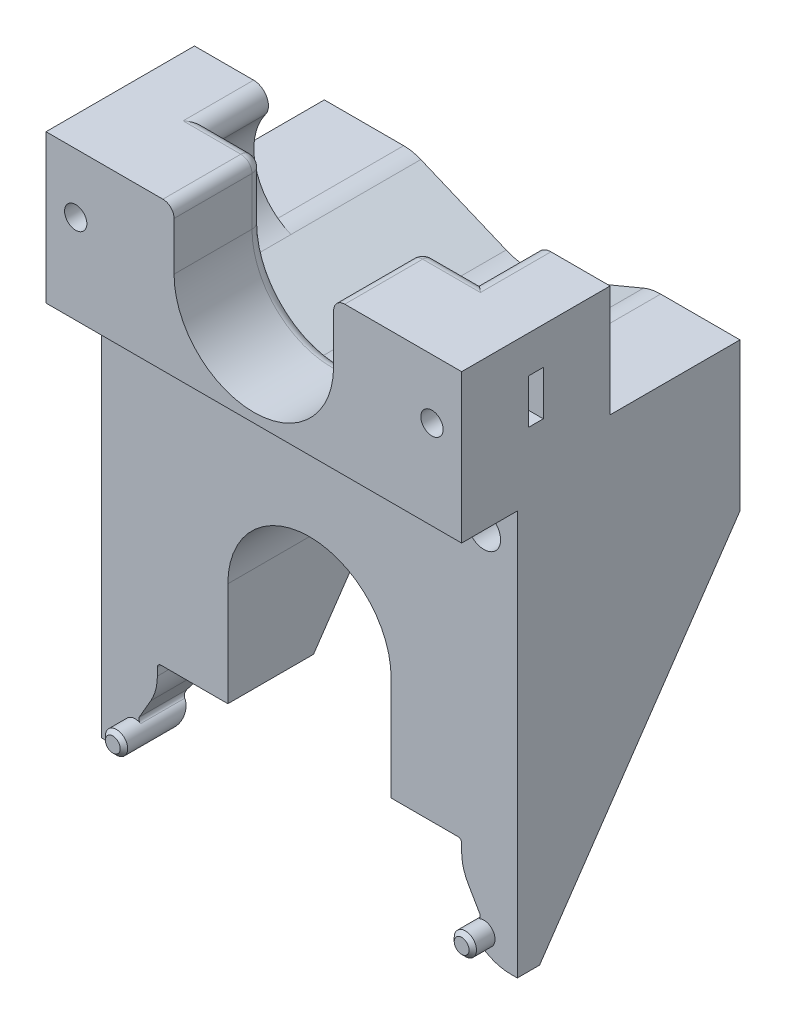
from build123d import *

# Parameters (mm, degrees)
BOSS_EXTRUDE1_DEPTH      = 28
BOSS_EXTRUDE1_DEPTH_BACK = 28
CUT_EXTRUDE1_REACH       = 65.151
BOSS_EXTRUDE2_START      = 3
SKETCH5_R                = 1.5000000000000009
BOSS_EXTRUDE2_DEPTH      = 3
CHAMFER1_SIZE            = 0.5
CUT_EXTRUDE2_REACH       = 65.151
SKETCH6_R                = 2.2499999999999987
SKETCH7_R                = 3.7499999999999996
CUT_EXTRUDE3_DEPTH       = 3
CUT_EXTRUDE4_REACH       = 69.039
CUT_EXTRUDE5_DEPTH       = 25.5
FILLET1_R                = 1.5
CUT_EXTRUDE6_DEPTH       = 17.5
CUT_EXTRUDE7_REACH       = 61.059
SKETCH11_R               = 1.5000000000000009
SKETCH11_R_2             = 1.4999999999999987
SKETCH12_W               = 6.9999999999999964
SKETCH12_H               = 5.999999999999993
CUT_EXTRUDE8_DEPTH       = 1


with BuildPart() as part:
    # Sketch3 → Boss-Extrude1 (new, two sides: drawn at the far end of the back side and taken through both)
    with BuildSketch(Plane(origin=(0, 0, 0), x_dir=(0, 0, -1), z_dir=(1, 0, 0)).offset(-BOSS_EXTRUDE1_DEPTH_BACK)):
        Polygon((0, -26.500000000000004), (0, 0), (0, 28.000000000000007), (-7.499999999999999, 28.000000000000007), (-7.5, 48), (29.999999999999996, 48.000000000000014), (30.000000000000004, 13.000000000000009), (3, -26.500000000000004), align=None)
    extrude(amount=BOSS_EXTRUDE1_DEPTH + BOSS_EXTRUDE1_DEPTH_BACK)

    # Cut-Extrude1: up to this plane
    cut_extrude1_end = Plane(origin=(27.999999999999993, 13.000000000000009, -30.000000000000004), z_dir=(0, 0.5643092286475101, 0.8255635011695056))
    # Sketch4 → Cut-Extrude1 (cut, up to the surface)
    with BuildSketch(Plane.XY, mode=Mode.PRIVATE) as cut_extrude1_sk1:
        with BuildLine():
            Line((-22.93301270189222, -21.517949192431118), (-21.387088719442275, -18.84033031018861))
            ThreePointArc((-21.387088719442275, -18.84033031018861), (-20.725616019582173, -17.24339394704681), (-20.5, -15.529670138408827))
            Line((-20.5, -15.529670138408827), (-20.5, -14.499999999999995))
            ThreePointArc((-20.5, -14.499999999999995), (-20.353553390593273, -14.146446609406722), (-20, -13.999999999999995))
            Line((-20, -13.999999999999995), (-10.999999999999998, -13.999999999999995))
            Line((-10.999999999999998, -13.999999999999995), (-11, -1.35e-15))
            ThreePointArc((-11, -1.35e-15), (-1.179e-14, 11), (10.999999999999993, 1.253e-14))
            Line((10.999999999999993, 1.253e-14), (10.999999999999991, -13.999999999999968))
            Line((10.999999999999991, -13.999999999999968), (20.000000000000007, -13.99999999999999))
            ThreePointArc((20.000000000000007, -13.99999999999999), (20.353553390593284, -14.146446609406715), (20.500000000000014, -14.499999999999991))
            Line((20.500000000000014, -14.499999999999991), (20.500000000000014, -15.529670138408822))
            ThreePointArc((20.500000000000014, -15.529670138408822), (20.725616019582187, -17.2433939470468), (21.38708871944229, -18.8403303101886))
            Line((21.38708871944229, -18.8403303101886), (22.933012701892235, -21.51794919243111))
            ThreePointArc((22.933012701892235, -21.51794919243111), (22.98296291314455, -21.897358714982374), (22.750000000000018, -22.200961894323335))
            ThreePointArc((22.750000000000018, -22.200961894323335), (22.012832707939275, -23.304210711669903), (22.43933982822019, -24.560660171779812))
            ThreePointArc((22.43933982822019, -24.560660171779812), (24.587450747697442, -25.99598200005571), (27.12132034355963, -26.499999999999993))
            Line((27.12132034355963, -26.499999999999993), (-27.12132034355962, -26.5))
            ThreePointArc((-27.12132034355962, -26.5), (-24.58745074769743, -25.99598200005572), (-22.43933982822018, -24.56066017177982))
            ThreePointArc((-22.43933982822018, -24.56066017177982), (-22.01283270793929, -23.30421071166992), (-22.750000000000004, -22.200961894323342))
            ThreePointArc((-22.750000000000004, -22.200961894323342), (-22.982962913144537, -21.89735871498238), (-22.93301270189222, -21.517949192431118))
        make_face()
    cut_extrude1_tool1 = split(extrude(cut_extrude1_sk1.sketch, amount=-CUT_EXTRUDE1_REACH, mode=Mode.PRIVATE), bisect_by=cut_extrude1_end, keep=Keep.BOTH, mode=Mode.PRIVATE)
    add(cut_extrude1_tool1.solids().sort_by_distance((0, -11.913251, 0))[0], mode=Mode.SUBTRACT)

    # Sketch5 → Boss-Extrude2 (add)
    with BuildSketch(Plane.XY.offset(BOSS_EXTRUDE2_START)):
        with Locations((23.499999999999996, -23.5)):
            Circle(SKETCH5_R)
        with Locations((-23.500000000000004, -23.5)):
            Circle(SKETCH5_R)
    extrude(amount=-BOSS_EXTRUDE2_DEPTH)

    # Chamfer1
    chamfer1_edges = [part.edges().sort_by_distance(p)[0] for p in [
        (21.999999999999996, -23.5, 3),
        (-25.000000000000004, -23.5, 3),
    ]]
    chamfer(chamfer1_edges, length=CHAMFER1_SIZE)

    # Sketch6 → Cut-Extrude2 (cut, up to next)
    with BuildSketch(Plane.XY, mode=Mode.PRIVATE) as cut_extrude2_sk1:
        with Locations((23.499999999999996, 23.5)):
            Circle(SKETCH6_R)
    cut_extrude2_tool1 = extrude(cut_extrude2_sk1.sketch, amount=-CUT_EXTRUDE2_REACH, mode=Mode.PRIVATE) & part.part
    # Sketch6 → Cut-Extrude2 (cut, up to next)
    with BuildSketch(Plane.XY, mode=Mode.PRIVATE) as cut_extrude2_sk2:
        with Locations((-23.500000000000004, 23.5)):
            Circle(SKETCH6_R)
    cut_extrude2_tool2 = extrude(cut_extrude2_sk2.sketch, amount=-CUT_EXTRUDE2_REACH, mode=Mode.PRIVATE) & part.part
    add(cut_extrude2_tool1.solids().sort_by_distance((23.5, 23.5, 0))[0], mode=Mode.SUBTRACT)
    add(cut_extrude2_tool2.solids().sort_by_distance((-23.5, 23.5, 0))[0], mode=Mode.SUBTRACT)

    # Sketch7 → Cut-Extrude3 (cut)
    with BuildSketch(Plane(origin=(0, 5.95e-15, -30.000000000000007), x_dir=(-1, 0, 0), z_dir=(0, 1.7e-16, -1))):
        with Locations(Location((-23.499999999999996, 23.5, 0), (0, 0, 90))):
            Circle(SKETCH7_R)
        with Locations(Location((23.500000000000004, 23.5, 0), (0, 0, 90))):
            Circle(SKETCH7_R)
    extrude(amount=-CUT_EXTRUDE3_DEPTH, mode=Mode.SUBTRACT)

    # Sketch8 → Cut-Extrude4 (cut, up to next)
    with BuildSketch(Plane(origin=(0, 5.95e-15, -30.000000000000007), x_dir=(-1, 0, 0), z_dir=(0, 2e-16, -1)), mode=Mode.PRIVATE) as cut_extrude4_sk1:
        with BuildLine():
            Line((-10.749999999999991, 40.000000000000014), (-10.749999999999993, 48.00000000000001))
            Line((-10.749999999999993, 48.00000000000001), (10.749999999999995, 48.00000000000001))
            Line((10.749999999999995, 48.00000000000001), (10.750000000000004, 40.000000000000014))
            ThreePointArc((10.750000000000004, 40.000000000000014), (4.96e-15, 29.250000000000014), (-10.749999999999991, 40.000000000000014))
        make_face()
    cut_extrude4_tool1 = extrude(cut_extrude4_sk1.sketch, amount=-CUT_EXTRUDE4_REACH, mode=Mode.PRIVATE) & part.part
    add(cut_extrude4_tool1.solids().sort_by_distance((0, 39.603429, -30))[0], mode=Mode.SUBTRACT)

    # Sketch9 → Cut-Extrude5 (cut)
    with BuildSketch(Plane(origin=(0, 5.95e-15, -30.000000000000007), x_dir=(-1, 0, 0), z_dir=(0, 2e-16, -1))):
        with BuildLine():
            Line((3.5000000000000053, 27.700862818523312), (15.002567384846198, 32.500000000000014))
            ThreePointArc((15.002567384846198, 32.500000000000014), (19.704089145058386, 37.826997771928276), (18.41995596409805, 44.815002787484154))
            ThreePointArc((18.41995596409805, 44.815002787484154), (18.246442865607545, 46.902775048106754), (20.03109891440682, 48.00000000000001))
            Line((20.03109891440682, 48.00000000000001), (-20.031098914406805, 48.000000000000014))
            ThreePointArc((-20.031098914406805, 48.000000000000014), (-18.24644286560753, 46.90277504810676), (-18.419955964098037, 44.81500278748416))
            ThreePointArc((-18.419955964098037, 44.81500278748416), (-19.70408914505838, 37.82699777192828), (-15.002567384846188, 32.500000000000014))
            Line((-15.002567384846188, 32.500000000000014), (-3.4999999999999947, 27.700862818523312))
            ThreePointArc((-3.4999999999999947, 27.700862818523312), (4.59e-15, 27.00000000000002), (3.5000000000000053, 27.700862818523312))
        make_face()
    extrude(amount=-CUT_EXTRUDE5_DEPTH, mode=Mode.SUBTRACT)

    # Fillet1
    fillet1_edges = [part.edges().sort_by_distance(p)[0] for p in [
        (10.749999999999993, 48.00000000000001, 1.5000000000000036),
        (-10.749999999999995, 48.00000000000001, 1.5000000000000036),
        (-10.75, 44.000000000000014, -4.499999999999998),
        (-15.390549457203406, 48.00000000000001, -4.499999999999997),
        (15.390549457203399, 48.000000000000014, -4.499999999999997),
        (-3.8e-15, 29.250000000000014, -4.500000000000002),
        (10.749999999999993, 44.000000000000014, -4.499999999999999),
    ]]
    fillet(fillet1_edges, radius=FILLET1_R)

    # Sketch10 → Cut-Extrude6 (cut)
    with BuildSketch(Plane(origin=(0, 5.95e-15, -30.000000000000007), x_dir=(-1, 0, 0), z_dir=(0, 2e-16, -1))):
        with BuildLine():
            Line((17.312884960931758, 32.96263305373123), (28.000000000000007, 32.962633053731224))
            Line((28.000000000000007, 32.962633053731224), (28.000000000000007, 48.00000000000001))
            Line((28.000000000000007, 48.00000000000001), (20.03109891440682, 48.00000000000001))
            ThreePointArc((20.03109891440682, 48.00000000000001), (18.24644286560754, 46.902775048106754), (18.41995596409805, 44.815002787484154))
            ThreePointArc((18.41995596409805, 44.815002787484154), (19.704089145058383, 37.826997771928276), (15.002567384846198, 32.500000000000014))
            ThreePointArc((15.002567384846198, 32.500000000000014), (16.1347936396864, 32.84583803391052), (17.312884960931758, 32.96263305373123))
        make_face()
        with BuildLine():
            Line((-17.312884960931758, 32.96263305373123), (-28.000000000000007, 32.962633053731224))
            Line((-28.000000000000007, 32.962633053731224), (-28.000000000000007, 48.00000000000001))
            Line((-28.000000000000007, 48.00000000000001), (-20.03109891440682, 48.00000000000001))
            ThreePointArc((-20.03109891440682, 48.00000000000001), (-18.24644286560754, 46.902775048106754), (-18.41995596409805, 44.815002787484154))
            ThreePointArc((-18.41995596409805, 44.815002787484154), (-19.704089145058383, 37.826997771928276), (-15.002567384846198, 32.500000000000014))
            ThreePointArc((-15.002567384846198, 32.500000000000014), (-16.1347936396864, 32.84583803391052), (-17.312884960931758, 32.96263305373123))
        make_face()
    extrude(amount=-CUT_EXTRUDE6_DEPTH, mode=Mode.SUBTRACT)

    # Sketch11 → Cut-Extrude7 (cut, up to next)
    with BuildSketch(Plane(origin=(0, 5.4e-16, -12.500000000000002), x_dir=(-1, 0, 0), z_dir=(0, 4e-17, -1)), mode=Mode.PRIVATE) as cut_extrude7_sk1:
        with Locations(Location((24.000000000000007, 40.00000000000002, 0), (0, 0, 90))):
            Circle(SKETCH11_R)
    cut_extrude7_tool1 = extrude(cut_extrude7_sk1.sketch, amount=-CUT_EXTRUDE7_REACH, mode=Mode.PRIVATE) & part.part
    # Sketch11 → Cut-Extrude7 (cut, up to next)
    with BuildSketch(Plane(origin=(0, 5.4e-16, -12.500000000000002), x_dir=(-1, 0, 0), z_dir=(0, 4e-17, -1)), mode=Mode.PRIVATE) as cut_extrude7_sk2:
        with Locations(Location((-24, 39.99999999999999, 0), (0, 0, 90))):
            Circle(SKETCH11_R_2)
    cut_extrude7_tool2 = extrude(cut_extrude7_sk2.sketch, amount=-CUT_EXTRUDE7_REACH, mode=Mode.PRIVATE) & part.part
    add(cut_extrude7_tool1.solids().sort_by_distance((-24, 40, -12.5))[0], mode=Mode.SUBTRACT)
    add(cut_extrude7_tool2.solids().sort_by_distance((24, 40, -12.5))[0], mode=Mode.SUBTRACT)

    # Sketch12 → Cut-Extrude8 (cut, symmetric)
    with BuildSketch(Plane(origin=(0, 1.1e-16, -2.5000000000000027), x_dir=(-1, 0, 0), z_dir=(0, 4e-17, -1))):
        with Locations((24.500000000000007, 40.00000000000003)):
            Rectangle(SKETCH12_W, SKETCH12_H)
        Polygon((-28.000000000000007, 43.000000000000014), (-28.000000000000007, 37.00000000000002), (-21.00000000000001, 37.00000000000003), (-21.00000000000001, 43.000000000000014), align=None)
    extrude(amount=CUT_EXTRUDE8_DEPTH, both=True, mode=Mode.SUBTRACT)


solid = part.part
